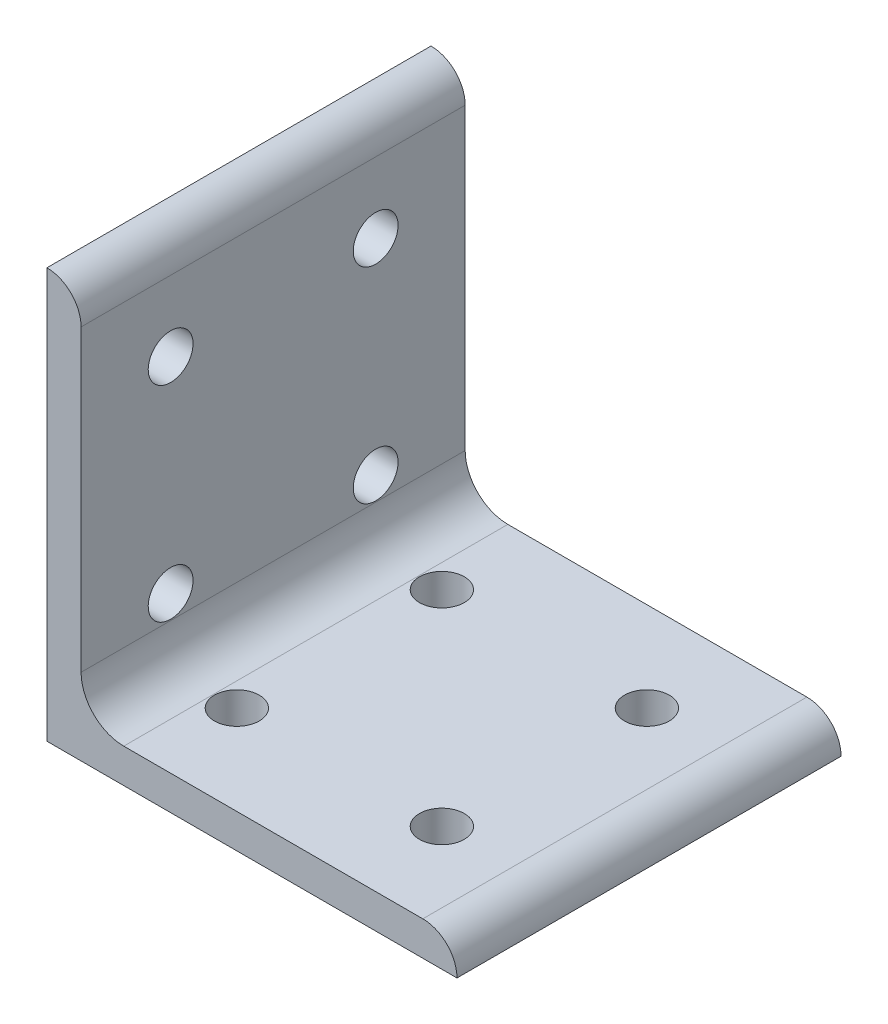
from build123d import *

# Parameters (mm, degrees)
BOSS_EXTRUDE1_DEPTH = 35.687
SKETCH2_R           = 4.1656
CUT_EXTRUDE1_DEPTH  = 114.518465322
SKETCH3_R           = 4.1656
CUT_EXTRUDE2_DEPTH  = 114.518465322


with BuildPart() as part:
    # Sketch1 → Boss-Extrude1 (new, symmetric)
    with BuildSketch(Plane.XY):
        with BuildLine():
            Line((0, 0), (0, 76.2))
            ThreePointArc((0, 76.2), (4.490128061, 74.340128061), (6.35, 69.85))
            Line((6.35, 69.85), (6.35, 14.2748))
            ThreePointArc((6.35, 14.2748), (8.67112018, 8.67112018), (14.2748, 6.35))
            Line((14.2748, 6.35), (69.85, 6.35))
            ThreePointArc((69.85, 6.35), (74.340128061, 4.490128061), (76.2, 0))
            Line((76.2, 0), (0, 0))
        make_face()
    extrude(amount=BOSS_EXTRUDE1_DEPTH, both=True)

    # Sketch2 → Cut-Extrude1 (cut, through all)
    with BuildSketch(Plane(origin=(0, 0, 0), x_dir=(1, 0, 0), z_dir=(0, 1, 0))):
        with Locations(Location((18.653125, -19.05, 0), (0, 0, 90))):
            Circle(SKETCH2_R)
        with Locations(Location((56.753125, -19.05, 0), (0, 0, 90))):
            Circle(SKETCH2_R)
        with Locations(Location((18.653125, 19.05, 0), (0, 0, 90))):
            Circle(SKETCH2_R)
        with Locations(Location((56.753125, 19.05, 0), (0, 0, 90))):
            Circle(SKETCH2_R)
    extrude(amount=CUT_EXTRUDE1_DEPTH, mode=Mode.SUBTRACT)

    # Sketch3 → Cut-Extrude2 (cut, through all)
    with BuildSketch(Plane(origin=(0, 0, 0), x_dir=(0, 0, -1), z_dir=(1, 0, 0))):
        with Locations(Location((-19.05, 18.653125, 0), (0, 0, 270))):
            Circle(SKETCH3_R)
        with Locations(Location((-19.05, 56.753125, 0), (0, 0, 270))):
            Circle(SKETCH3_R)
        with Locations(Location((19.05, 18.653125, 0), (0, 0, 270))):
            Circle(SKETCH3_R)
        with Locations(Location((19.05, 56.753125, 0), (0, 0, 270))):
            Circle(SKETCH3_R)
    extrude(amount=CUT_EXTRUDE2_DEPTH, mode=Mode.SUBTRACT)


solid = part.part
